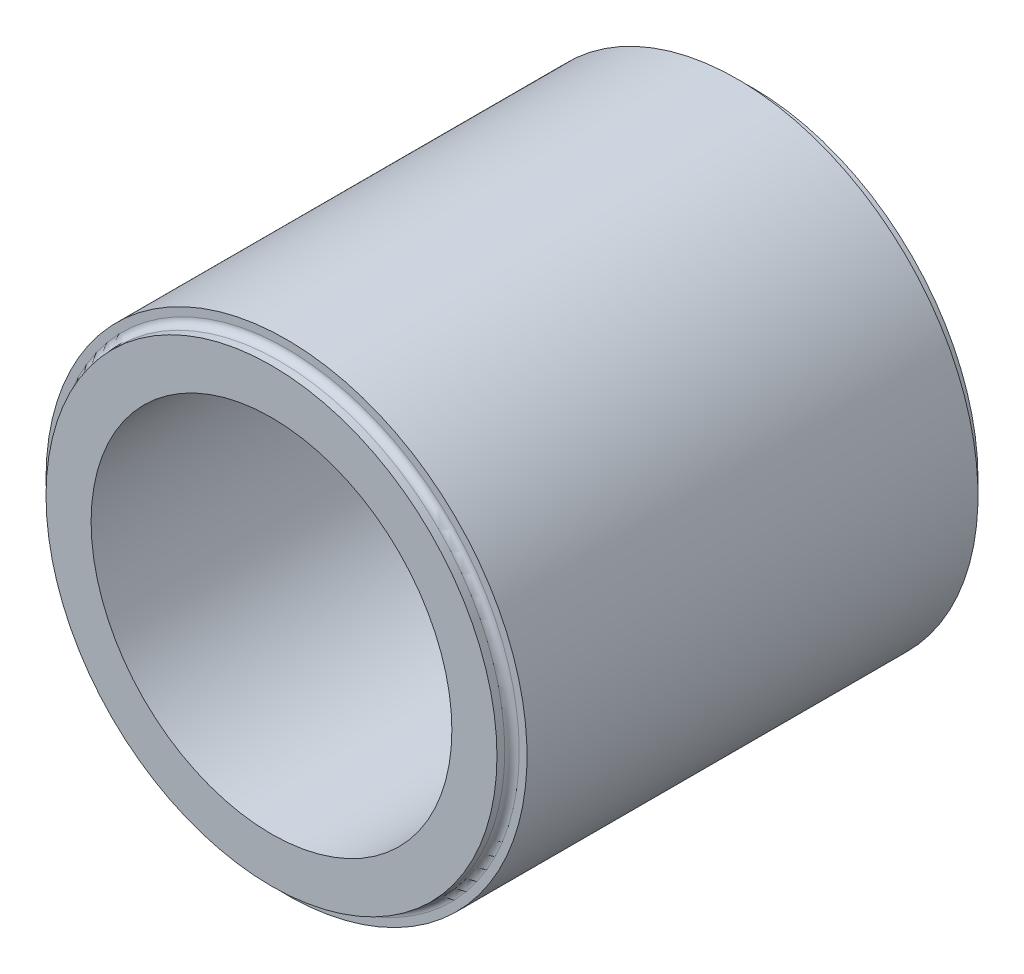
from build123d import *

# Parameters (mm, degrees)
SKETCH1_R           = 25.4
SKETCH1_R_2         = 19.05
BOSS_EXTRUDE1_DEPTH = 50.8
SKETCH4_R           = 25.4
SKETCH4_R_2         = 23.8125
CUT_EXTRUDE1_DEPTH  = 1.5875
FILLET1_R           = 0.762


with BuildPart() as part:
    # Sketch1 → Boss-Extrude1 (new body)
    with BuildSketch(Plane.XY):
        Circle(SKETCH1_R)
        Circle(SKETCH1_R_2, mode=Mode.SUBTRACT)
    extrude(amount=BOSS_EXTRUDE1_DEPTH)

    # Sketch4 → Cut-Extrude1 (cut)
    with BuildSketch(Plane(origin=(0, 0, 0), x_dir=(-1, 0, 0), z_dir=(0, 0, -1))):
        Circle(SKETCH4_R)
        Circle(SKETCH4_R_2, mode=Mode.SUBTRACT)
    cut_extrude1 = extrude(amount=-CUT_EXTRUDE1_DEPTH, mode=Mode.SUBTRACT)

    # Mirror1: Cut-Extrude1 across plane
    add(cut_extrude1.mirror(Plane.XY.offset(25.4)), mode=Mode.SUBTRACT)

    # Fillet1
    fillet1_edges = [part.edges().sort_by_distance(p)[0] for p in [
        (23.8125, 0, 1.5875),
        (23.8125, 0, 49.2125),
    ]]
    fillet(fillet1_edges, radius=FILLET1_R)


solid = part.part
